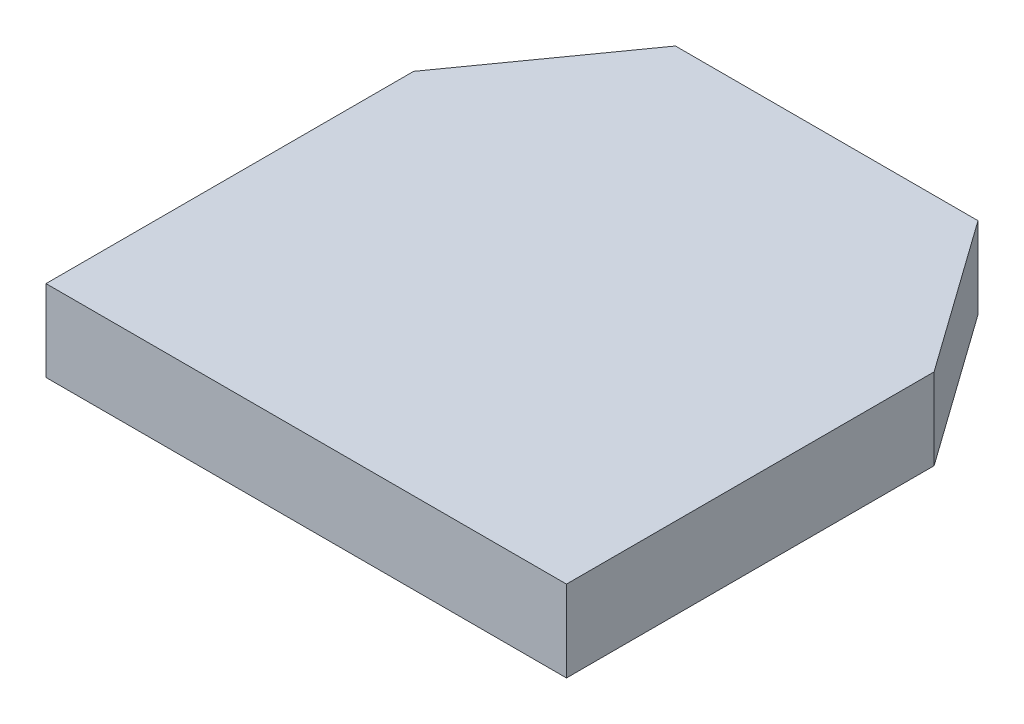
from build123d import *

# Parameters (mm, degrees)
BOSS_EXTRUDE1_DEPTH = 6.35


with BuildPart() as part:
    # Sketch1 → Boss-Extrude1 (new body)
    with BuildSketch(Plane(origin=(0, 0, 0), x_dir=(1, 0, 0), z_dir=(0, 1, 0))):
        Polygon((0, 28.702), (8.509, 40.64), (32.131, 40.64), (40.64, 28.702), (40.64, 0), (0, 0), align=None)
    extrude(amount=BOSS_EXTRUDE1_DEPTH)


solid = part.part
